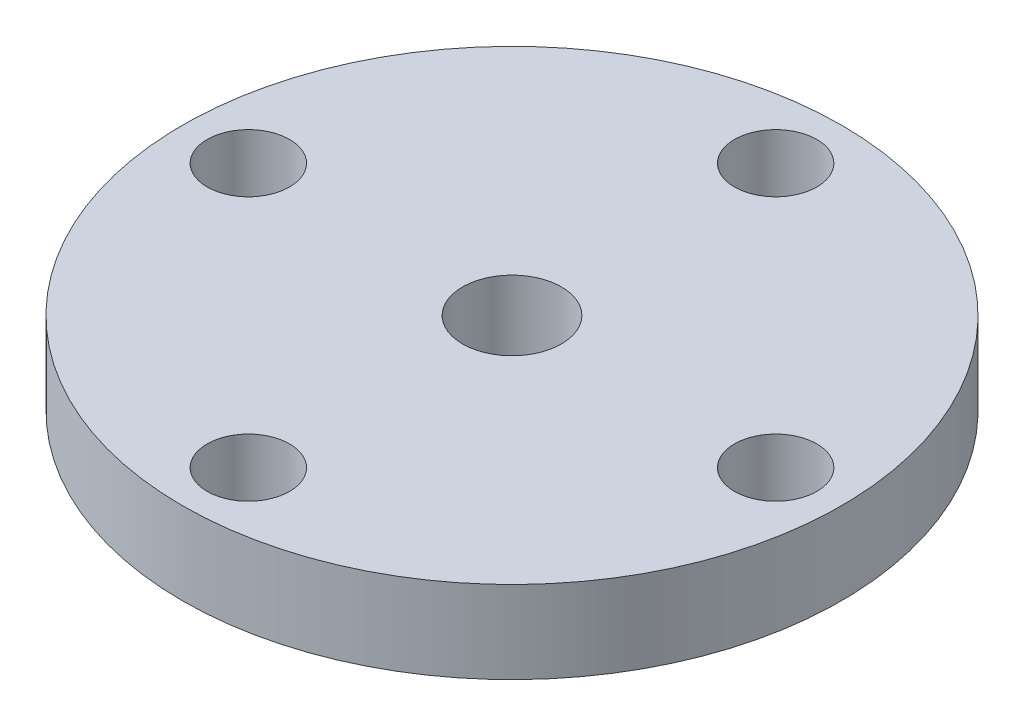
from build123d import *

# Parameters (mm, degrees)
SKETCH1_R           = 10
SKETCH1_R_2         = 1.25
SKETCH1_R_3         = 1.5
BOSS_EXTRUDE1_DEPTH = 2.5


with BuildPart() as part:
    # Sketch1 → Boss-Extrude1 (new body)
    with BuildSketch(Plane(origin=(0, 0, 0), x_dir=(1, 0, 0), z_dir=(0, 1, 0))):
        with Locations(Location((0, 0, 0), (0, 0, 270))):
            Circle(SKETCH1_R)
        with Locations(Location((-8, 0, 0), (0, 0, 270))):
            Circle(SKETCH1_R_2, mode=Mode.SUBTRACT)
        with Locations(Location((0, -8, 0), (0, 0, 270))):
            Circle(SKETCH1_R_2, mode=Mode.SUBTRACT)
        with Locations(Location((8, 0, 0), (0, 0, 270))):
            Circle(SKETCH1_R_2, mode=Mode.SUBTRACT)
        with Locations(Location((0, 8, 0), (0, 0, 270))):
            Circle(SKETCH1_R_2, mode=Mode.SUBTRACT)
        with Locations(Location((0, 0, 0), (0, 0, 270))):
            Circle(SKETCH1_R_3, mode=Mode.SUBTRACT)
    extrude(amount=BOSS_EXTRUDE1_DEPTH)


solid = part.part
